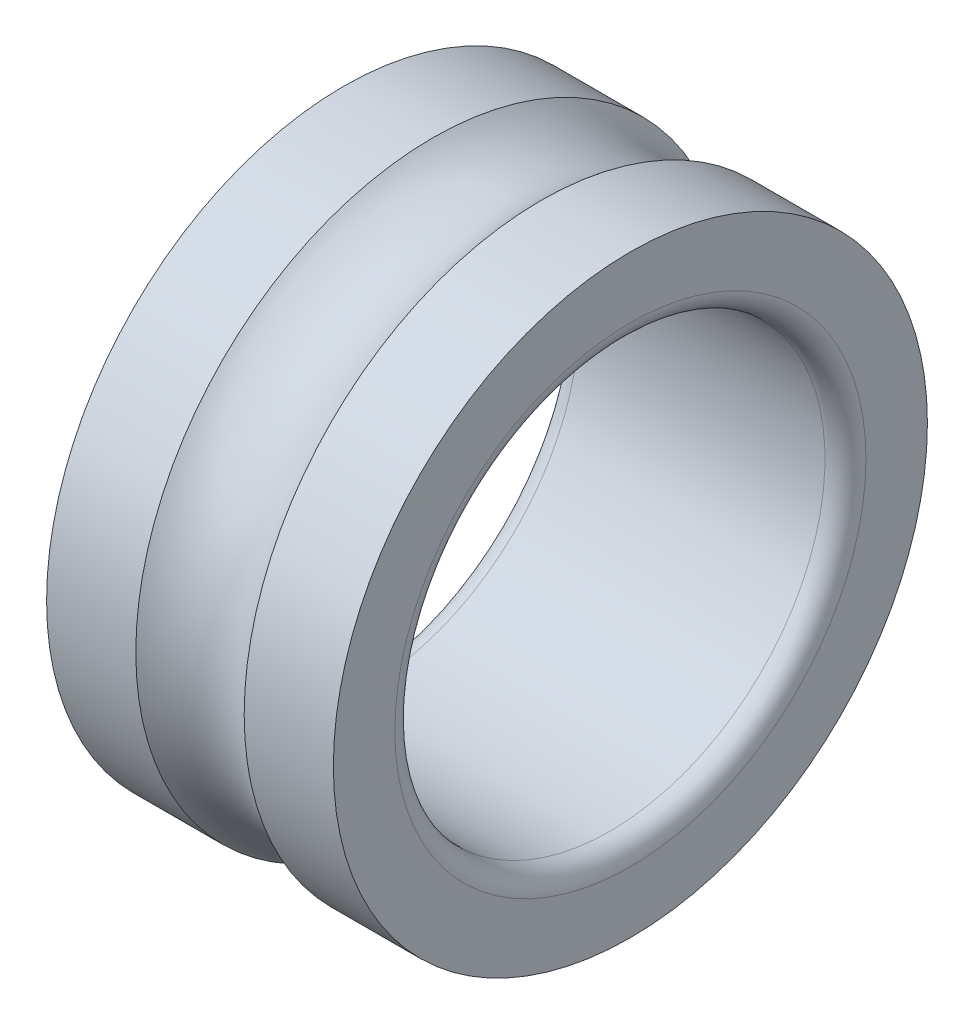
from build123d import *


with BuildPart() as part:
    # Esquisse1 → Base-Révolution (revolve)
    with BuildSketch(Plane.XY):
        with BuildLine():
            Line((-3.428571429, 6), (3.428571429, 6))
            ThreePointArc((3.428571429, 6), (3.832632446, 6.167367554), (4, 6.571428571))
            Line((4, 6.571428571), (4, 8.285714286))
            Line((4, 8.285714286), (1.511857892, 8.285714286))
            ThreePointArc((1.511857892, 8.285714286), (0, 7.714285714), (-1.511857892, 8.285714286))
            Line((-1.511857892, 8.285714286), (-4, 8.285714286))
            Line((-4, 8.285714286), (-4, 6.571428571))
            ThreePointArc((-4, 6.571428571), (-3.832632446, 6.167367554), (-3.428571429, 6))
        make_face()
    revolve(axis=Axis((0, 0, 0), (1, 0, 0)))


solid = part.part
